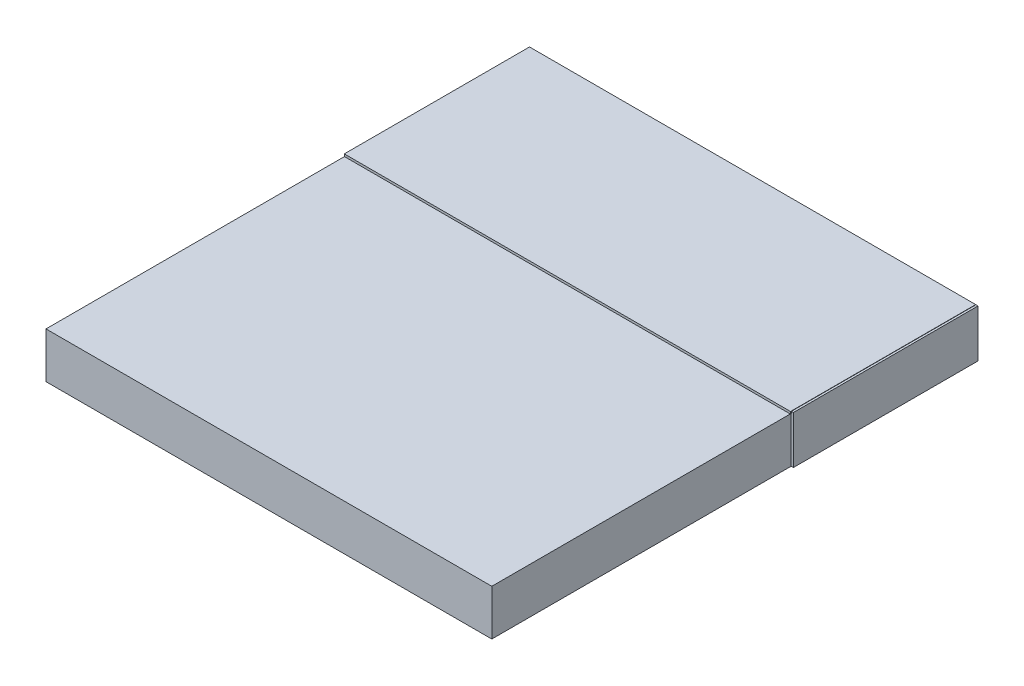
from build123d import *

# Parameters (mm, degrees)
SKETCH1_W           = 19.502846838
SKETCH1_H           = 21.171639364
BOSS_EXTRUDE1_DEPTH = 2
SKETCH2_W           = 19.520422618
SKETCH2_H           = 8.102119128
BOSS_EXTRUDE2_DEPTH = 0.1
SKETCH3_W           = 8.074665446
SKETCH3_H           = 2.084637803
BOSS_EXTRUDE3_DEPTH = 0.1


with BuildPart() as part:
    # Sketch1 → Boss-Extrude1 (new body)
    with BuildSketch(Plane(origin=(0, 0, 0), x_dir=(1, 0, 0), z_dir=(0, 1, 0))):
        Rectangle(SKETCH1_W, SKETCH1_H)
    extrude(amount=BOSS_EXTRUDE1_DEPTH)

    # Sketch2 → Boss-Extrude2 (add)
    with BuildSketch(Plane(origin=(0, 2, 0), x_dir=(1, 0, 0), z_dir=(0, 1, 0))):
        with Locations((0.002445022, 6.52141887)):
            Rectangle(SKETCH2_W, SKETCH2_H)
    extrude(amount=BOSS_EXTRUDE2_DEPTH)

    # Sketch3 → Boss-Extrude3 (add)
    with BuildSketch(Plane(origin=(9.751423419, 0, 0), x_dir=(0, 0, -1), z_dir=(1, 0, 0))):
        with Locations((6.546986064, 1.043505293)):
            Rectangle(SKETCH3_W, SKETCH3_H)
    extrude(amount=BOSS_EXTRUDE3_DEPTH)


solid = part.part
